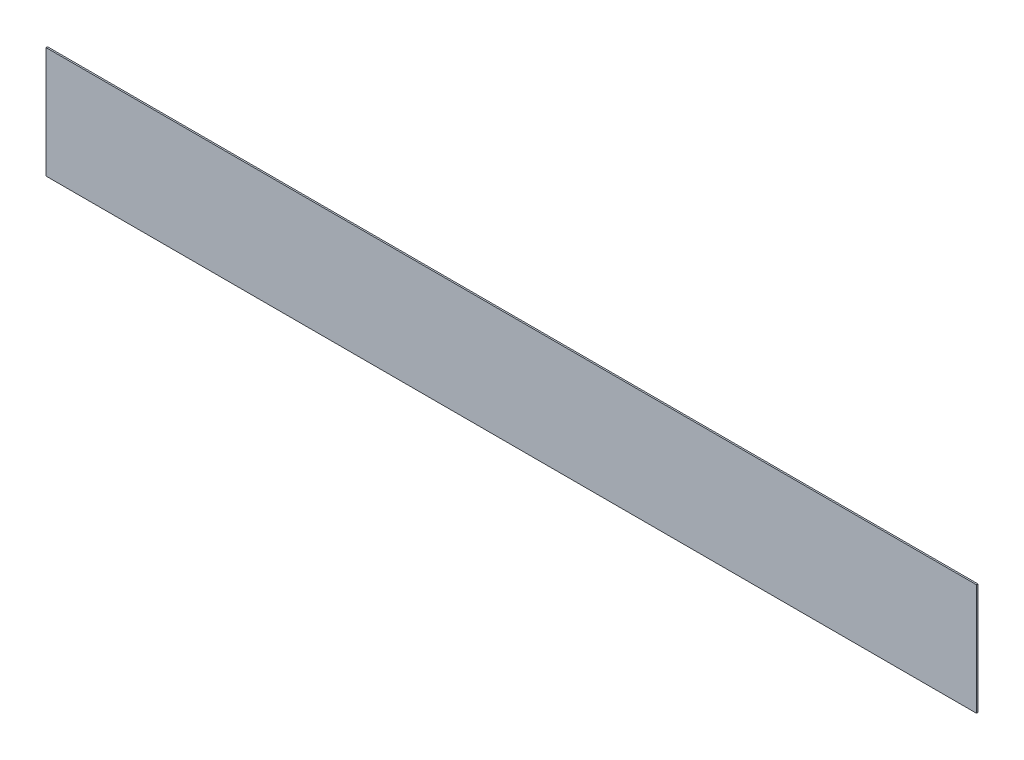
from build123d import *

# Parameters (mm, degrees)
SKETCH1_W           = 2508
SKETCH1_H           = 300
BOSS_EXTRUDE1_DEPTH = 4


with BuildPart() as part:
    # Sketch1 → Boss-Extrude1 (new body)
    with BuildSketch(Plane.XY):
        Rectangle(SKETCH1_W, SKETCH1_H)
    extrude(amount=BOSS_EXTRUDE1_DEPTH)


solid = part.part
